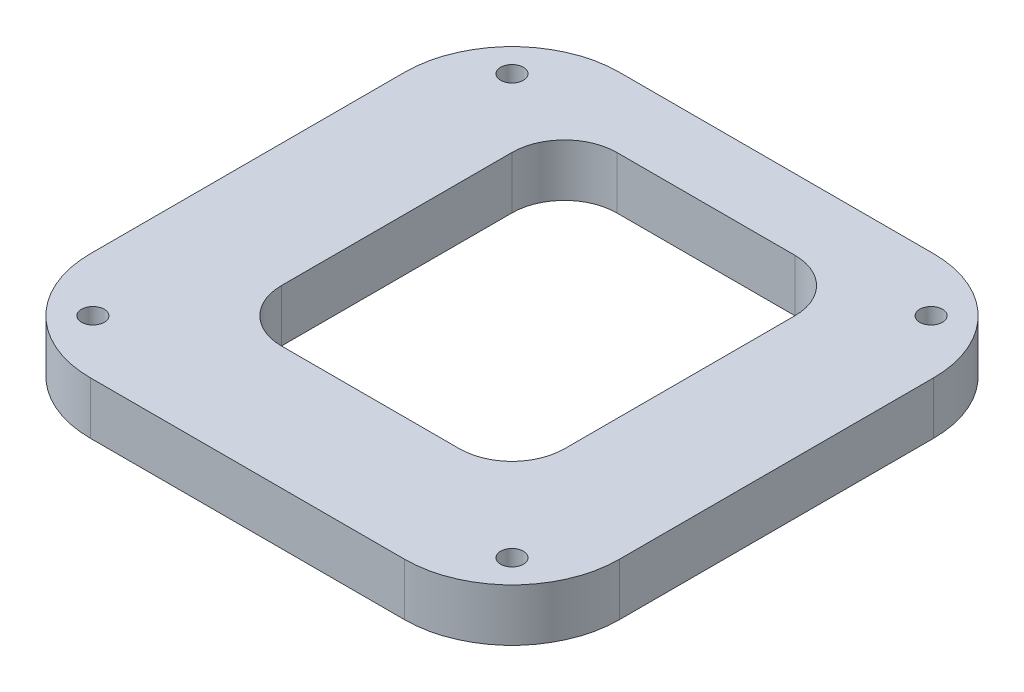
from build123d import *

# Parameters (mm, degrees)
SKETCH_1_W          = 101
SKETCH_1_H          = 101
SKETCH_1_W_2        = 54
SKETCH_1_H_2        = 64
EXTRUDE_1_DEPTH     = 10
FILLET_1_R          = 20.5
FILLET_2_R          = 10
SKETCH_2_R          = 2.166
CUT_EXTRUDE_1_DEPTH = 73.114492302


with BuildPart() as part:
    # 草图1 → 凸台-拉伸1 (new body)
    with BuildSketch(Plane(origin=(0, 0, 0), x_dir=(1, 0, 0), z_dir=(0, 1, 0))):
        Rectangle(SKETCH_1_W, SKETCH_1_H)
        with Locations((0, 5)):
            Rectangle(SKETCH_1_W_2, SKETCH_1_H_2, mode=Mode.SUBTRACT)
    extrude(amount=EXTRUDE_1_DEPTH)

    # 圆角1
    fillet_1_edges = [part.edges().sort_by_distance(p)[0] for p in [
        (-50.5, 5, -50.5),
        (50.5, 5, -50.5),
        (50.5, 5, 50.5),
        (-50.5, 5, 50.5),
    ]]
    fillet(fillet_1_edges, radius=FILLET_1_R)

    # 圆角2
    fillet_2_edges = [part.edges().sort_by_distance(p)[0] for p in [
        (-27, 5, -37),
        (-27, 5, 27),
        (27, 5, 27),
        (27, 5, -37),
    ]]
    fillet(fillet_2_edges, radius=FILLET_2_R)

    # 草图2 → 切除-拉伸1 (cut, through all)
    with BuildSketch(Plane(origin=(0, 10, 0), x_dir=(1, 0, 0), z_dir=(0, 1, 0))):
        with Locations(Location((-40, 40, 0), (0, 0, 270))):
            Circle(SKETCH_2_R)
        with Locations(Location((40, 40, 0), (0, 0, 270))):
            Circle(SKETCH_2_R)
        with Locations(Location((-40, -40, 0), (0, 0, 270))):
            Circle(SKETCH_2_R)
        with Locations(Location((40, -40, 0), (0, 0, 270))):
            Circle(SKETCH_2_R)
    extrude(amount=-CUT_EXTRUDE_1_DEPTH, mode=Mode.SUBTRACT)


solid = part.part
